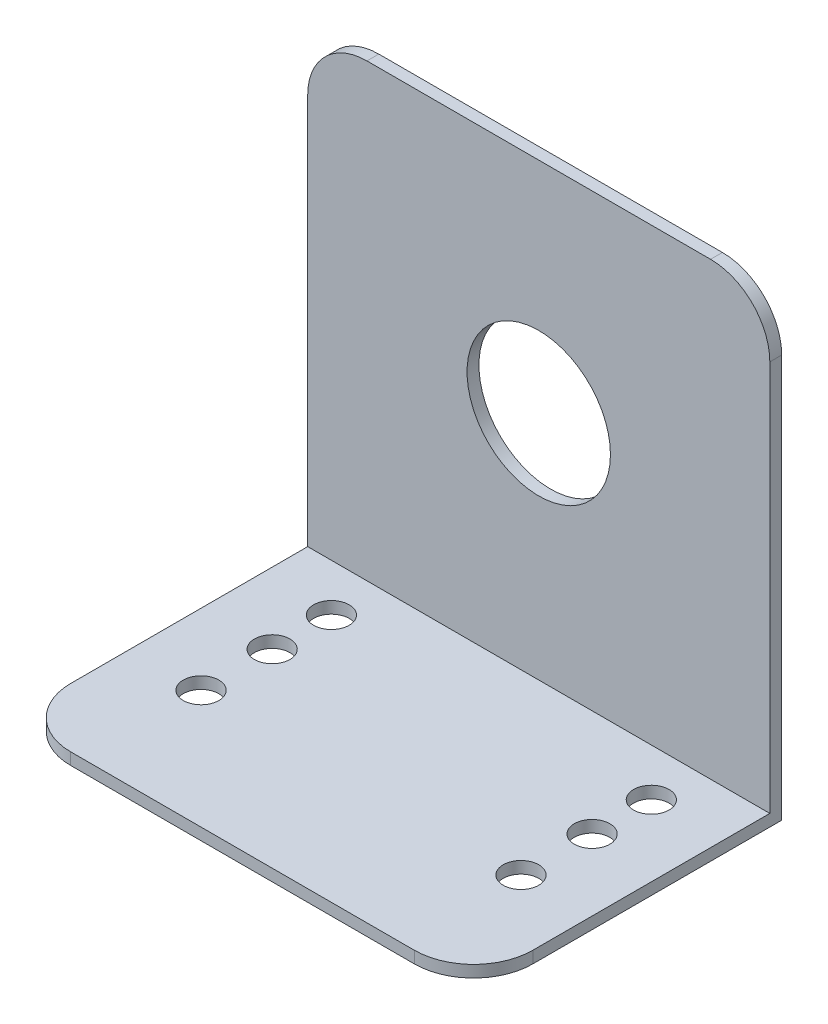
from build123d import *

# Parameters (mm, degrees)
SKETCH1_W           = 39
SKETCH1_H           = 39
BOSS_EXTRUDE1_DEPTH = 1
SKETCH2_W           = 39
SKETCH2_H           = 1
BOSS_EXTRUDE2_DEPTH = 25
SKETCH5_R           = 1.5
CUT_EXTRUDE2_DEPTH  = 1
SKETCH6_R           = 1.5
CUT_EXTRUDE3_DEPTH  = 1
FILLET1_R           = 5
SKETCH7_R           = 6.05
CUT_EXTRUDE4_DEPTH  = 1


with BuildPart() as part:
    # Sketch1 → Boss-Extrude1 (new body)
    with BuildSketch(Plane.XY):
        Rectangle(SKETCH1_W, SKETCH1_H)
    extrude(amount=BOSS_EXTRUDE1_DEPTH)

    # Sketch2 → Boss-Extrude2 (add)
    with BuildSketch(Plane.XY.offset(1)):
        with Locations((0, -19)):
            Rectangle(SKETCH2_W, SKETCH2_H)
    extrude(amount=BOSS_EXTRUDE2_DEPTH)

    # Sketch5 → Cut-Extrude2 (cut)
    with BuildSketch(Plane.XZ.offset(19.5)):
        with Locations(Location((13.5, 5, 0), (0, 0, 270))):
            Circle(SKETCH5_R)
        with Locations(Location((13.5, 10, 0), (0, 0, 270))):
            Circle(SKETCH5_R)
        with Locations(Location((13.5, 16, 0), (0, 0, 270))):
            Circle(SKETCH5_R)
    extrude(amount=-CUT_EXTRUDE2_DEPTH, mode=Mode.SUBTRACT)

    # Sketch6 → Cut-Extrude3 (cut)
    with BuildSketch(Plane.XZ.offset(19.5)):
        with Locations(Location((-13.5, 16, 0), (0, 0, 270))):
            Circle(SKETCH6_R)
        with Locations(Location((-13.5, 10, 0), (0, 0, 270))):
            Circle(SKETCH6_R)
        with Locations(Location((-13.5, 5, 0), (0, 0, 270))):
            Circle(SKETCH6_R)
    extrude(amount=-CUT_EXTRUDE3_DEPTH, mode=Mode.SUBTRACT)

    # Fillet1
    fillet1_edges = [part.edges().sort_by_distance(p)[0] for p in [
        (-19.5, -19, 26),
        (19.5, -19, 26),
        (-19.5, 19.5, 0.5),
        (19.5, 19.5, 0.5),
    ]]
    fillet(fillet1_edges, radius=FILLET1_R)

    # Sketch7 → Cut-Extrude4 (cut)
    with BuildSketch(Plane.XY):
        with Locations((0, 1)):
            Circle(SKETCH7_R)
    extrude(amount=CUT_EXTRUDE4_DEPTH, mode=Mode.SUBTRACT)


solid = part.part
